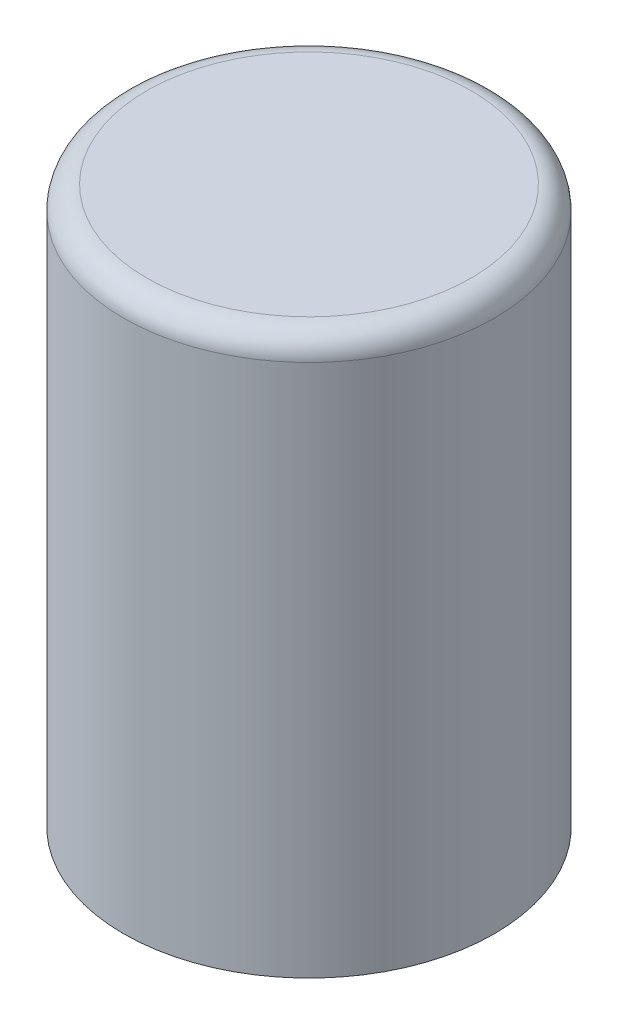
from build123d import *

# Parameters (mm, degrees)
SKETCH1_R           = 2
BOSS_EXTRUDE1_DEPTH = 6
FILLET1_R           = 0.25


with BuildPart() as part:
    # Sketch1 → Boss-Extrude1 (new body)
    with BuildSketch(Plane(origin=(0, 0, 0), x_dir=(1, 0, 0), z_dir=(0, 1, 0))):
        with Locations(Location((0, 0, 0), (0, 0, 270))):
            Circle(SKETCH1_R)
    extrude(amount=BOSS_EXTRUDE1_DEPTH)

    # Fillet1
    fillet1_edges = [part.edges().sort_by_distance(p)[0] for p in [
        (0, 6, -2),
    ]]
    fillet(fillet1_edges, radius=FILLET1_R)


solid = part.part
